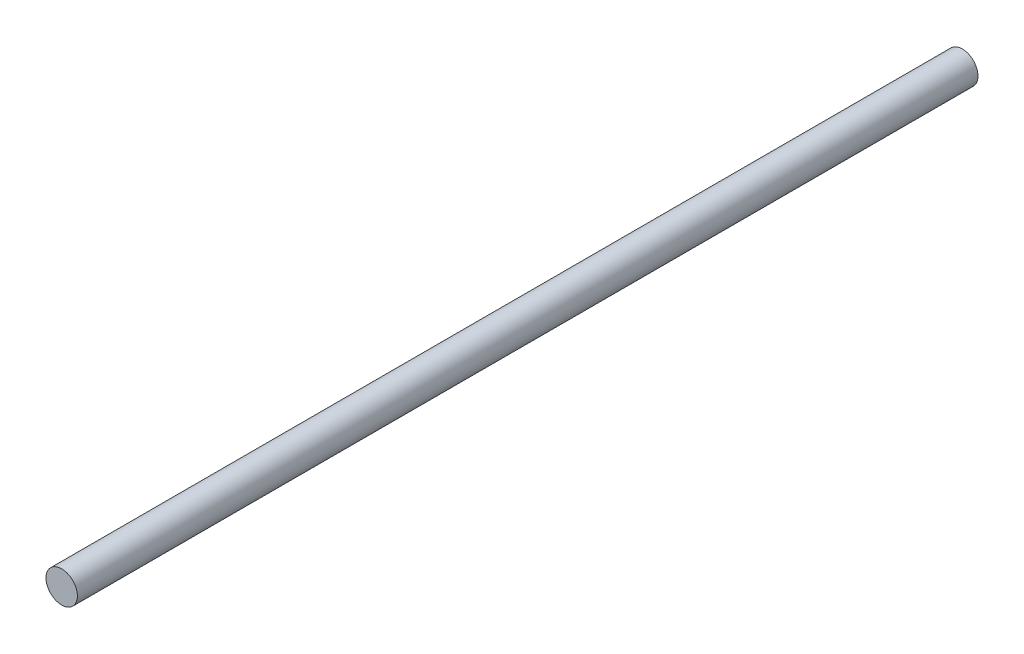
from build123d import *

# Parameters (mm, degrees)
SKETCH1_R           = 3.175
BOSS_EXTRUDE1_DEPTH = 91


with BuildPart() as part:
    # Sketch1 → Boss-Extrude1 (new, symmetric)
    with BuildSketch(Plane.XY):
        Circle(SKETCH1_R)
    extrude(amount=BOSS_EXTRUDE1_DEPTH, both=True)


solid = part.part
